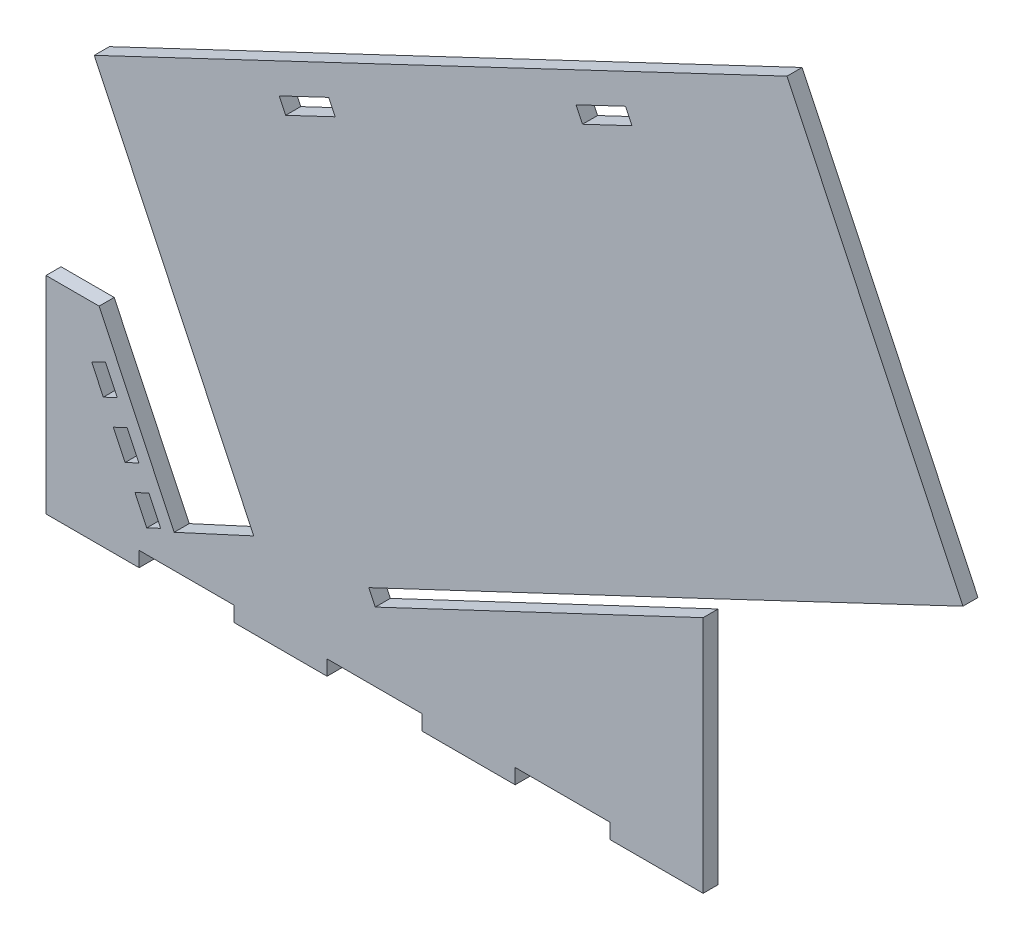
from build123d import *

# Parameters (mm, degrees)
SALIENTE_EXTRUIR1_DEPTH = 5.5
CORTAR_EXTRUIR1_DEPTH   = 5.5
CORTAR_EXTRUIR4_DEPTH   = 5.5
CORTAR_EXTRUIR5_DEPTH   = 5.5


with BuildPart() as part:
    # Croquis1 → Saliente-Extruir1 (new body)
    with BuildSketch(Plane.XY):
        Polygon((180, 0), (180, 93.289473684), (274.896352923, 138.268626086), (210.65044876, 273.81368796), (-42.36700007, 153.888000188), (15.880022719, 30.999289839), (-13.188895459, 17.615531012), (-40.600481236, 75.448090745), (-60, 75.448090745), (-60, 0), (-26, 0), (-26, 5.5), (8.66, 5.5), (8.66, 0), (42.66, 0), (42.66, 5.5), (77.34, 5.5), (77.34, 0), (111.34, 0), (111.34, 5.5), (146, 5.5), (146, 0), align=None)
    extrude(amount=SALIENTE_EXTRUIR1_DEPTH)

    # Croquis2 → Cortar-Extruir1 (cut)
    with BuildSketch(Plane.XY.offset(5.5)):
        Polygon((180, 93.289473684), (57.917117024, 35.663353874), (60.264847831, 30.68960679), (180, 87.207539986), align=None)
    extrude(amount=-CORTAR_EXTRUIR1_DEPTH, mode=Mode.SUBTRACT)

    # Croquis4 → Cortar-Extruir4 (cut)
    with BuildSketch(Plane.XY.offset(5.5)):
        Polygon((-43.332939479, 56.464331481), (-38.272590503, 58.862845236), (-33.989530225, 49.826507778), (-39.049879202, 47.427994023), align=None)
        Polygon((-35.409277966, 39.747107183), (-30.348928989, 42.145620939), (-26.065868712, 33.10928348), (-31.126217688, 30.710769725), align=None)
        Polygon((-27.485616452, 23.029882886), (-22.425267476, 25.428396641), (-18.142207198, 16.392059183), (-23.202556175, 13.993545427), align=None)
    extrude(amount=-CORTAR_EXTRUIR4_DEPTH, mode=Mode.SUBTRACT)

    # Croquis5 → Cortar-Extruir5 (cut)
    with BuildSketch(Plane.XY.offset(5.5)):
        Polygon((25.170422415, 174.833084673), (27.526105568, 169.863099071), (45.598780484, 178.429219626), (43.243097332, 183.399205228), align=None)
        Polygon((133.606471914, 226.229808004), (151.67914683, 234.795928559), (154.034829983, 229.825942957), (135.962155066, 221.259822402), align=None)
    extrude(amount=-CORTAR_EXTRUIR5_DEPTH, mode=Mode.SUBTRACT)


solid = part.part
